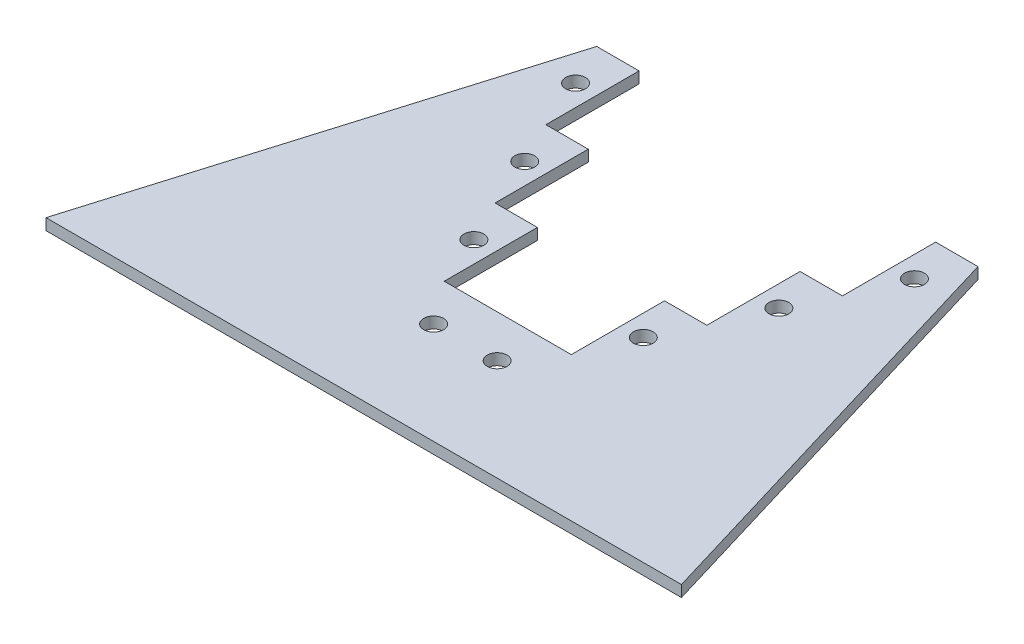
from build123d import *

# Parameters (mm, degrees)
BOSS_EXTRUDE2_DEPTH = 4
SKETCH2_R           = 3.5
CUT_EXTRUDE1_DEPTH  = 4
SKETCH3_W           = 225
SKETCH3_H           = 150
BOSS_EXTRUDE3_DEPTH = 4


with BuildPart() as part:
    # Sketch1 → Boss-Extrude2 (new body)
    with BuildSketch(Plane(origin=(0, 0, 0), x_dir=(1, 0, 0), z_dir=(0, 1, 0))):
        Polygon((-120, 117), (-120, 150), (-135, 150), (-180, 0), (-135, 0), (0, 0), (45, 0), (0, 150), (-15, 150), (-15, 117), (-30, 117), (-30, 84), (-45, 84), (-45, 51), (-90, 51), (-90, 84), (-105, 84), (-105, 117), align=None)
    extrude(amount=BOSS_EXTRUDE2_DEPTH)

    # Sketch2 → Cut-Extrude1 (cut)
    with BuildSketch(Plane(origin=(0, 4, 0), x_dir=(1, 0, 0), z_dir=(0, 1, 0))):
        with Locations(Location((-127.5, 135, 0), (0, 0, 270))):
            Circle(SKETCH2_R)
        with Locations(Location((-112.5, 102, 0), (0, 0, 270))):
            Circle(SKETCH2_R)
        with Locations(Location((-97.5, 69, 0), (0, 0, 270))):
            Circle(SKETCH2_R)
        with Locations(Location((-78.75, 36, 0), (0, 0, 270))):
            Circle(SKETCH2_R)
        with Locations(Location((-56.25, 36, 0), (0, 0, 90))):
            Circle(SKETCH2_R)
        with Locations(Location((-37.5, 69, 0), (0, 0, 90))):
            Circle(SKETCH2_R)
        with Locations(Location((-22.5, 102, 0), (0, 0, 90))):
            Circle(SKETCH2_R)
        with Locations(Location((-7.5, 135, 0), (0, 0, 90))):
            Circle(SKETCH2_R)
    extrude(amount=-CUT_EXTRUDE1_DEPTH, mode=Mode.SUBTRACT)

    # Sketch3 → Boss-Extrude3 (add)
    with BuildSketch(Plane(origin=(0, 4, 0), x_dir=(1, 0, 0), z_dir=(0, 1, 0))):
        with Locations((-67.5, -75)):
            Rectangle(SKETCH3_W, SKETCH3_H)
    extrude(amount=BOSS_EXTRUDE3_DEPTH)


with BuildPart() as boss_extrude3_kept_piece:
    # of the separate pieces the step leaves, the one the design keeps (boss_extrude3_pieces_kept)
    add(part.part.solids().sort_by_distance((-120, 0, -117))[0])


solid = boss_extrude3_kept_piece.part
